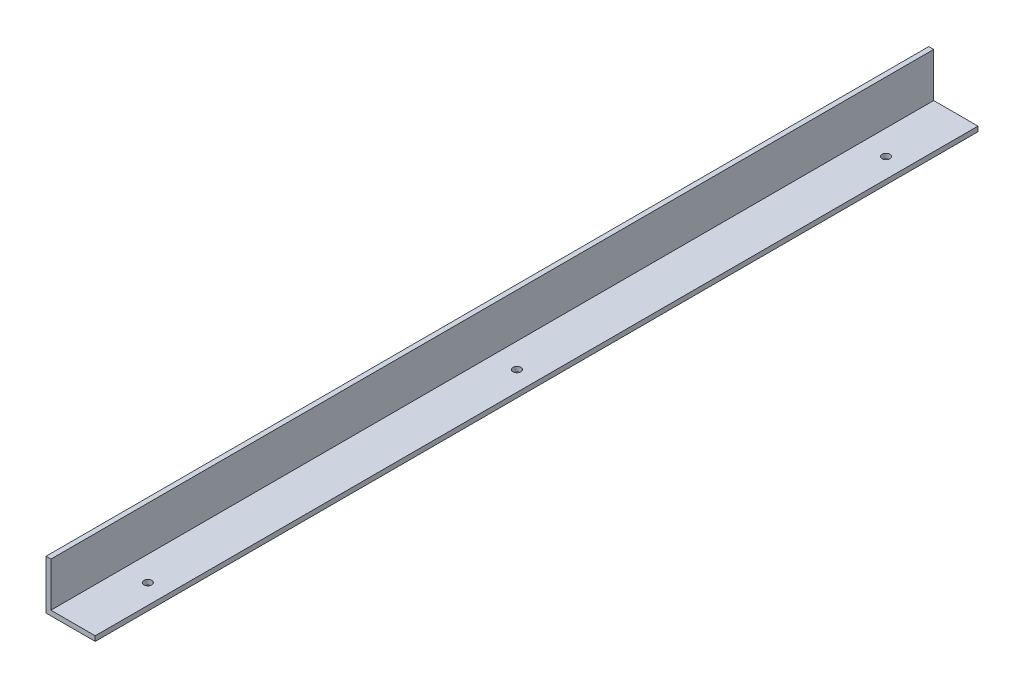
from build123d import *

# Parameters (mm, degrees)
BOSS_EXTRUDE1_DEPTH = 448.5
SKETCH2_R           = 4
CUT_EXTRUDE1_DEPTH  = 10
LPATTERN1_COUNT     = 3
LPATTERN1_PITCH     = 375


with BuildPart() as part:
    # Sketch1 → Boss-Extrude1 (new, symmetric)
    with BuildSketch(Plane.XY):
        Polygon((-18.924824174, 31.469740292), (-18.924824174, -13.530259708), (26.075175826, -13.530259708), (26.075175826, -18.530259708), (-23.924824174, -18.530259708), (-23.924824174, 31.469740292), align=None)
    extrude(amount=BOSS_EXTRUDE1_DEPTH, both=True)

    # Sketch2 → Cut-Extrude1 (cut)
    with BuildSketch(Plane.XZ.offset(18.530259708)):
        with Locations((6.075175826, 375)):
            Circle(SKETCH2_R)
    cut_extrude1 = extrude(amount=-CUT_EXTRUDE1_DEPTH, mode=Mode.SUBTRACT)

    # LPattern1: Cut-Extrude1 ×3
    with Locations(*[(0, 0, -i * LPATTERN1_PITCH) for i in range(1, LPATTERN1_COUNT)]):
        add(cut_extrude1, mode=Mode.SUBTRACT)


solid = part.part
